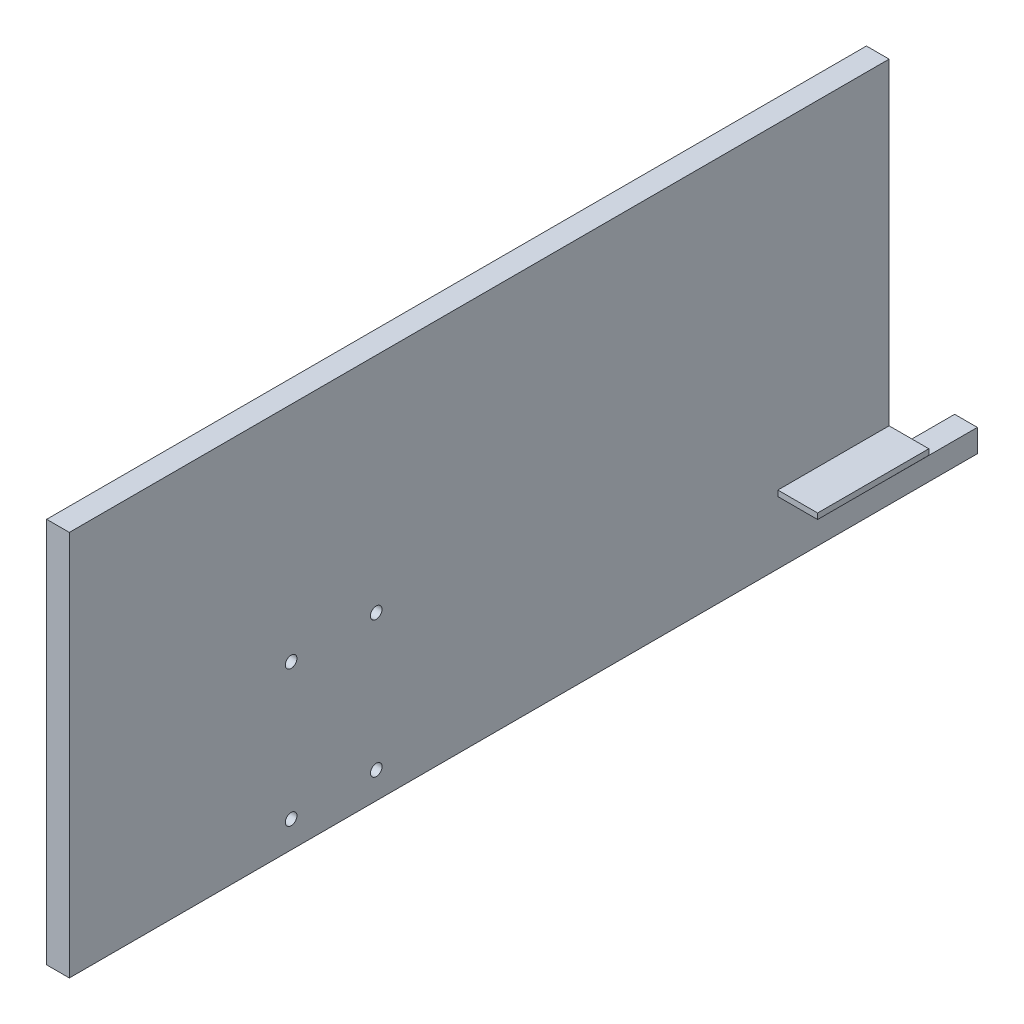
from build123d import *

# Parameters (mm, degrees)
SKETCH_1_W              = 20
SKETCH_1_H              = 340
EXTRUDE_1_DEPTH         = 800
HOLE_WIZARD_M12_1_D     = 10.2
HOLE_WIZARD_M12_1_DEPTH = 11.935610843
HOLE_WIZARD_M12_1_TIP   = 3.064389157
SKETCH_5_W              = 77.75
SKETCH_5_H              = 319.875
CUT_EXTRUDE_1_DEPTH     = 819.107572389
SKETCH_6_W              = 98
SKETCH_6_H              = 5
EXTRUDE_2_DEPTH         = 35


with BuildPart() as part:
    # 草图1 → 凸台-拉伸1 (new body)
    with BuildSketch(Plane.XY):
        Rectangle(SKETCH_1_W, SKETCH_1_H)
    extrude(amount=EXTRUDE_1_DEPTH)

    # M12 螺纹孔1
    with Locations(Plane(origin=(10, 0, 0), x_dir=(0, 0, -1), z_dir=(1, 0, 0))):
        with Locations((-529.599389894, -26.421356237), (-529.599389894, -146.421356237), (-604.599389894, -146.421356237), (-604.599389894, -26.421356237)):
            Hole(HOLE_WIZARD_M12_1_D / 2, depth=HOLE_WIZARD_M12_1_DEPTH)
            with Locations((0, 0, -(HOLE_WIZARD_M12_1_DEPTH + HOLE_WIZARD_M12_1_TIP / 2))):  # 118° drill point
                Cone(0, HOLE_WIZARD_M12_1_D / 2, HOLE_WIZARD_M12_1_TIP, mode=Mode.SUBTRACT)

    # 草图5 → 切除-拉伸1 (cut, through all)
    with BuildSketch(Plane(origin=(10, 0, 0), x_dir=(0, 0, -1), z_dir=(1, 0, 0))):
        with Locations((-38.875, 10.0625)):
            Rectangle(SKETCH_5_W, SKETCH_5_H)
    extrude(amount=-CUT_EXTRUDE_1_DEPTH, mode=Mode.SUBTRACT)

    # 草图6 → 凸台-拉伸2 (add)
    with BuildSketch(Plane(origin=(10, 0, 0), x_dir=(0, 0, -1), z_dir=(1, 0, 0))):
        with Locations((-126.75, -112.3)):
            Rectangle(SKETCH_6_W, SKETCH_6_H)
    extrude(amount=EXTRUDE_2_DEPTH)


solid = part.part
